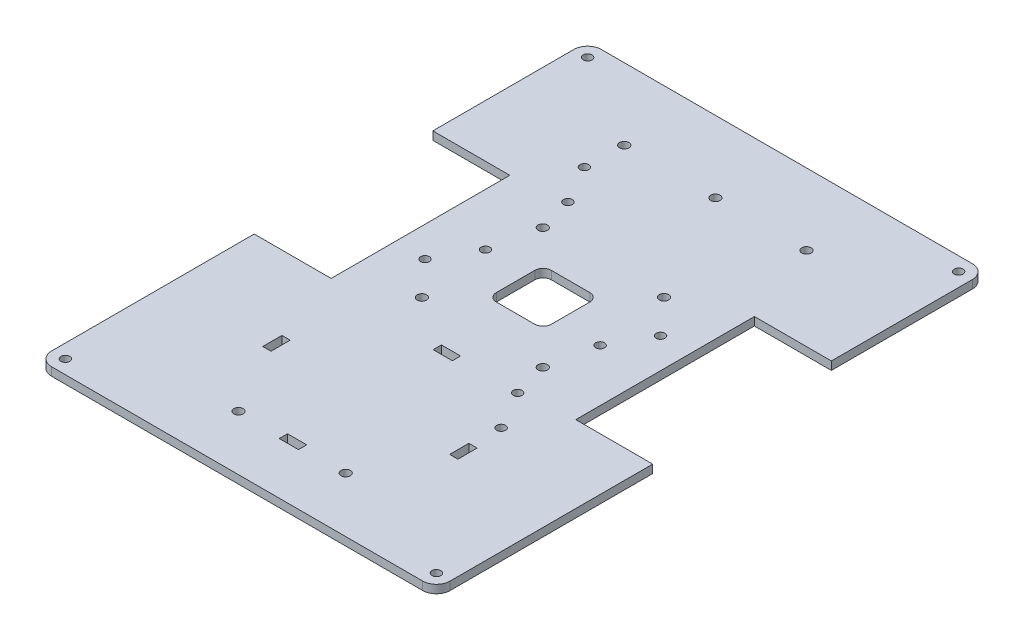
from build123d import *

# Parameters (mm, degrees)
SKETCH_1_R      = 1.6
SKETCH_1_R_2    = 1.7
SKETCH_1_W      = 3
SKETCH_1_H      = 7
SKETCH_1_W_2    = 7
SKETCH_1_H_2    = 3
EXTRUDE_2_DEPTH = 3


with BuildPart() as part:
    # 草图1 → 凸台-拉伸2 (new body)
    with BuildSketch(Plane(origin=(0, 0, 0), x_dir=(1, 0, 0), z_dir=(0, 1, 0))):
        with BuildLine():
            Line((67.5, 100), (-67.5, 100))
            ThreePointArc((-67.5, 100), (-71.035533906, 98.535533906), (-72.5, 95))
            Line((-72.5, 95), (-72.5, 43.7))
            Line((-72.5, 43.7), (-44.5, 43.7))
            Line((-44.5, 43.7), (-44.5, -21.3))
            Line((-44.5, -21.3), (-72.5, -21.3))
            Line((-72.5, -21.3), (-72.5, -95))
            ThreePointArc((-72.5, -95), (-71.035533906, -98.535533906), (-67.5, -100))
            Line((-67.5, -100), (67.5, -100))
            ThreePointArc((67.5, -100), (71.035533906, -98.535533906), (72.5, -95))
            Line((72.5, -95), (72.5, -21.3))
            Line((72.5, -21.3), (44.5, -21.3))
            Line((44.5, -21.3), (44.5, 43.7))
            Line((44.5, 43.7), (72.5, 43.7))
            Line((72.5, 43.7), (72.5, 95))
            ThreePointArc((72.5, 95), (71.035533906, 98.535533906), (67.5, 100))
        make_face()
        with Locations(Location((-67.5, -95, 0), (0, 0, 270))):
            Circle(SKETCH_1_R, mode=Mode.SUBTRACT)
        with Locations(Location((-19.5, -80, 0), (0, 0, 270))):
            Circle(SKETCH_1_R_2, mode=Mode.SUBTRACT)
        with Locations((-34, -51.69160916)):
            Rectangle(SKETCH_1_W, SKETCH_1_H, mode=Mode.SUBTRACT)
        with Locations(Location((-22, -10.8, 0), (0, 0, 270))):
            Circle(SKETCH_1_R_2, mode=Mode.SUBTRACT)
        with Locations((0, -79.69160916)):
            Rectangle(SKETCH_1_W_2, SKETCH_1_H_2, mode=Mode.SUBTRACT)
        with Locations(Location((19.5, -80, 0), (0, 0, 270))):
            Circle(SKETCH_1_R_2, mode=Mode.SUBTRACT)
        with Locations((34, -51.69160916)):
            Rectangle(SKETCH_1_W, SKETCH_1_H, mode=Mode.SUBTRACT)
        with Locations(Location((67.5, -95, 0), (0, 0, 270))):
            Circle(SKETCH_1_R, mode=Mode.SUBTRACT)
        with Locations(Location((33.5, -37.45, 0), (0, 0, 270))):
            Circle(SKETCH_1_R, mode=Mode.SUBTRACT)
        with Locations((0, -23.69160916)):
            Rectangle(SKETCH_1_W_2, SKETCH_1_H_2, mode=Mode.SUBTRACT)
        with Locations(Location((25.5, -23.45, 0), (0, 0, 270))):
            Circle(SKETCH_1_R, mode=Mode.SUBTRACT)
        with Locations(Location((22, -10.8, 0), (0, 0, 270))):
            Circle(SKETCH_1_R_2, mode=Mode.SUBTRACT)
        with Locations(Location((-33.5, 1.85, 0), (0, 0, 270))):
            Circle(SKETCH_1_R, mode=Mode.SUBTRACT)
        with Locations(Location((-25.5, 15.85, 0), (0, 0, 270))):
            Circle(SKETCH_1_R, mode=Mode.SUBTRACT)
        with Locations(Location((-22, 33.2, 0), (0, 0, 270))):
            Circle(SKETCH_1_R_2, mode=Mode.SUBTRACT)
        with Locations(Location((-25.5, 45.85, 0), (0, 0, 270))):
            Circle(SKETCH_1_R, mode=Mode.SUBTRACT)
        with Locations(Location((-67.5, 95, 0), (0, 0, 270))):
            Circle(SKETCH_1_R, mode=Mode.SUBTRACT)
        with Locations(Location((-33.5, 59.85, 0), (0, 0, 270))):
            Circle(SKETCH_1_R, mode=Mode.SUBTRACT)
        with Locations(Location((-33.15, 74, 0), (0, 0, 270))):
            Circle(SKETCH_1_R_2, mode=Mode.SUBTRACT)
        with BuildLine():
            ThreePointArc((-10, 18.30839084), (-9.121320344, 20.429711183), (-7, 21.30839084))
            Line((-7, 21.30839084), (7, 21.30839084))
            ThreePointArc((7, 21.30839084), (9.121320344, 20.429711183), (10, 18.30839084))
            Line((10, 18.30839084), (10, 4.30839084))
            ThreePointArc((10, 4.30839084), (9.121320344, 2.187070496), (7, 1.30839084))
            Line((7, 1.30839084), (-7, 1.30839084))
            ThreePointArc((-7, 1.30839084), (-9.121320344, 2.187070496), (-10, 4.30839084))
            Line((-10, 4.30839084), (-10, 18.30839084))
        make_face(mode=Mode.SUBTRACT)
        with Locations(Location((25.5, 6.55, 0), (0, 0, 270))):
            Circle(SKETCH_1_R, mode=Mode.SUBTRACT)
        with Locations(Location((33.5, 20.55, 0), (0, 0, 270))):
            Circle(SKETCH_1_R, mode=Mode.SUBTRACT)
        with Locations(Location((22, 33.30839084, 0), (0, 0, 270))):
            Circle(SKETCH_1_R_2, mode=Mode.SUBTRACT)
        with Locations(Location((0, 74, 0), (0, 0, 270))):
            Circle(SKETCH_1_R_2, mode=Mode.SUBTRACT)
        with Locations(Location((33.15, 74, 0), (0, 0, 270))):
            Circle(SKETCH_1_R_2, mode=Mode.SUBTRACT)
        with Locations(Location((67.5, 95, 0), (0, 0, 270))):
            Circle(SKETCH_1_R, mode=Mode.SUBTRACT)
    extrude(amount=EXTRUDE_2_DEPTH)


solid = part.part
